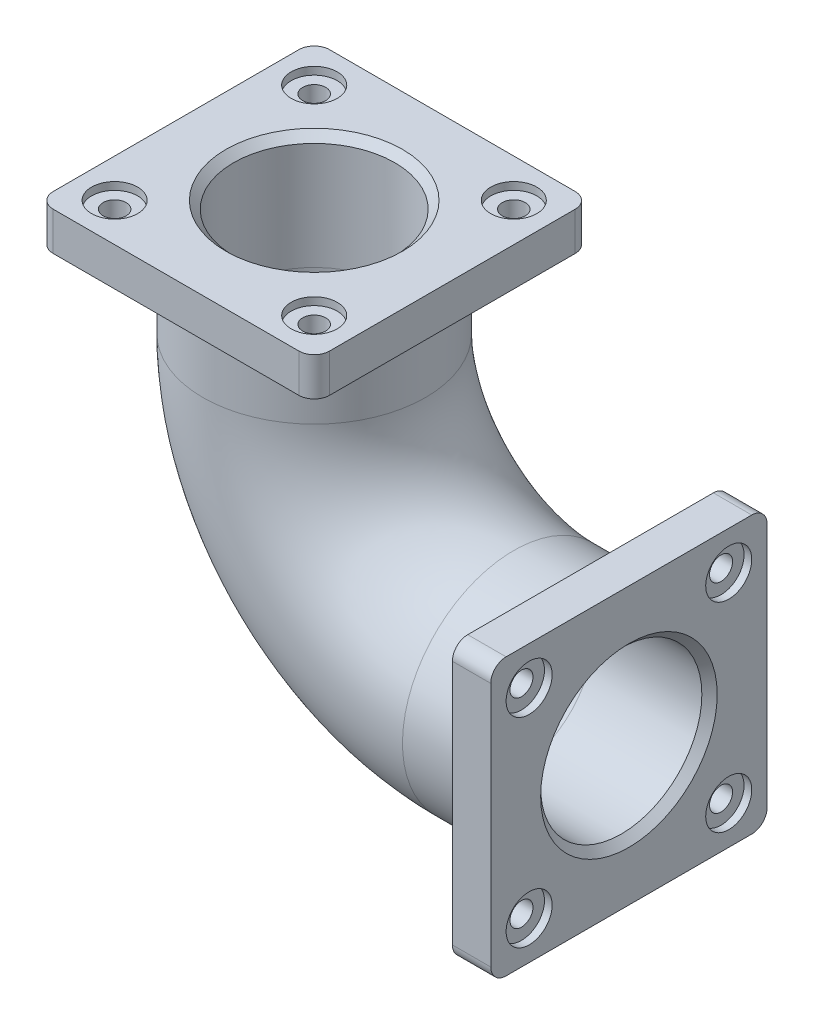
from build123d import *

# Parameters (mm, degrees)
SKETCH2_R           = 145
SKETCH2_R_2         = 105
BOSS_EXTRUDE1_START = -50
SKETCH3_W           = 360
SKETCH3_H           = 360
SKETCH3_R           = 145
BOSS_EXTRUDE1_DEPTH = 50
FILLET1_R           = 20
SKETCH4_R           = 145
BOSS_EXTRUDE2_DEPTH = 50
SKETCH5_R           = 30
CUT_EXTRUDE1_DEPTH  = 10
SKETCH6_R           = 15
CUT_EXTRUDE2_DEPTH  = 86
CIRPATTERN1_COUNT   = 4
SKETCH9_R           = 30
CUT_EXTRUDE3_DEPTH  = 10
CUT_EXTRUDE4_REACH  = 848.699
SKETCH10_R          = 15
CIRPATTERN2_COUNT   = 4
CHAMFER1_SIZE       = 10


with BuildPart() as part:
    # Sweep-Thin1: sweep along a path in Sketch1
    with BuildLine(Plane.XY) as sweep_thin1_path:
        Line((0, 0), (-150, 0))
        ThreePointArc((-150, 0), (-333.847763109, 76.152236891), (-410, 260))
        Line((-410, 260), (-410, 410))
    # Sketch2 → Sweep-Thin1 (sweep)
    with BuildSketch(Plane(origin=(0, 0, 0), x_dir=(0, 0, -1), z_dir=(1, 0, 0))):
        Circle(SKETCH2_R)
        Circle(SKETCH2_R_2, mode=Mode.SUBTRACT)
    sweep(path=sweep_thin1_path.line)

    # Sketch3 → Boss-Extrude1 (add)
    with BuildSketch(Plane(origin=(0, 0, 0), x_dir=(0, 0, -1), z_dir=(1, 0, 0)).offset(BOSS_EXTRUDE1_START)):
        Rectangle(SKETCH3_W, SKETCH3_H)
        with Locations(Location((0, 0, 0), (0, 0, 270))):
            Circle(SKETCH3_R, mode=Mode.SUBTRACT)
    extrude(amount=BOSS_EXTRUDE1_DEPTH)

    # Fillet1
    fillet1_edges = [part.edges().sort_by_distance(p)[0] for p in [
        (-25, 180, -180),
        (-25, -180, -180),
        (-25, -180, 180),
        (-25, 180, 180),
    ]]
    fillet(fillet1_edges, radius=FILLET1_R)

    # Sketch4 → Boss-Extrude2 (add)
    with BuildSketch(Plane(origin=(0, 410, 0), x_dir=(1, 0, 0), z_dir=(0, 1, 0))):
        with BuildLine():
            Line((-570, 180), (-250, 180))
            ThreePointArc((-250, 180), (-235.857864376, 174.142135624), (-230, 160))
            Line((-230, 160), (-230, -160))
            ThreePointArc((-230, -160), (-235.857864376, -174.142135624), (-250, -180))
            Line((-250, -180), (-570, -180))
            ThreePointArc((-570, -180), (-584.142135624, -174.142135624), (-590, -160))
            Line((-590, -160), (-590, 160))
            ThreePointArc((-590, 160), (-584.142135624, 174.142135624), (-570, 180))
        make_face()
        with Locations(Location((-410, 0, 0), (0, 0, 270))):
            Circle(SKETCH4_R, mode=Mode.SUBTRACT)
    extrude(amount=-BOSS_EXTRUDE2_DEPTH)

    # Sketch5 → Cut-Extrude1 (cut)
    with BuildSketch(Plane(origin=(0, 0, 0), x_dir=(0, 0, -1), z_dir=(1, 0, 0))):
        with Locations((-130, 130)):
            Circle(SKETCH5_R)
    cut_extrude1 = extrude(amount=-CUT_EXTRUDE1_DEPTH, mode=Mode.SUBTRACT)

    # Sketch6 → Cut-Extrude2 (cut)
    with BuildSketch(Plane(origin=(-10, 0, 0), x_dir=(0, 0, -1), z_dir=(1, 0, 0))):
        with Locations((-130, 130)):
            Circle(SKETCH6_R)
    cut_extrude2 = extrude(amount=-CUT_EXTRUDE2_DEPTH, mode=Mode.SUBTRACT)

    # CirPattern1: Cut-Extrude1, Cut-Extrude2 ×4 about axis
    cirpattern1_axis = Axis((0, 0, 0), (1, 0, 0))
    add([cut_extrude1.rotate(cirpattern1_axis, i * 360 / CIRPATTERN1_COUNT) for i in range(1, CIRPATTERN1_COUNT)], mode=Mode.SUBTRACT)
    add([cut_extrude2.rotate(cirpattern1_axis, i * 360 / CIRPATTERN1_COUNT) for i in range(1, CIRPATTERN1_COUNT)], mode=Mode.SUBTRACT)

    # Sketch9 → Cut-Extrude3 (cut)
    with BuildSketch(Plane(origin=(0, 410, 0), x_dir=(1, 0, 0), z_dir=(0, 1, 0))):
        with Locations(Location((-540, 130, 0), (0, 0, 270))):
            Circle(SKETCH9_R)
    cut_extrude3 = extrude(amount=-CUT_EXTRUDE3_DEPTH, mode=Mode.SUBTRACT)

    # Sketch10 → Cut-Extrude4 (cut, up to next)
    with BuildSketch(Plane(origin=(0, 400, 0), x_dir=(1, 0, 0), z_dir=(0, 1, 0)), mode=Mode.PRIVATE) as cut_extrude4_sk1:
        with Locations(Location((-540, 130, 0), (0, 0, 270))):
            Circle(SKETCH10_R)
    cut_extrude4_tool1 = extrude(cut_extrude4_sk1.sketch, amount=-CUT_EXTRUDE4_REACH, mode=Mode.PRIVATE) & part.part
    cut_extrude4 = cut_extrude4_tool1.solids().sort_by_distance((-540, 400, -130))[0]
    add(cut_extrude4, mode=Mode.SUBTRACT)

    # CirPattern2: Cut-Extrude3, Cut-Extrude4 ×4 about axis
    cirpattern2_axis = Axis((-410, 0, 0), (0, 1, 0))
    add([cut_extrude3.rotate(cirpattern2_axis, i * 360 / CIRPATTERN2_COUNT) for i in range(1, CIRPATTERN2_COUNT)], mode=Mode.SUBTRACT)
    add([cut_extrude4.rotate(cirpattern2_axis, i * 360 / CIRPATTERN2_COUNT) for i in range(1, CIRPATTERN2_COUNT)], mode=Mode.SUBTRACT)

    # Chamfer1
    chamfer1_edges = [part.edges().sort_by_distance(p)[0] for p in [
        (0, 0, 105),
        (-410, 410, 105),
    ]]
    chamfer(chamfer1_edges, length=CHAMFER1_SIZE)


solid = part.part
